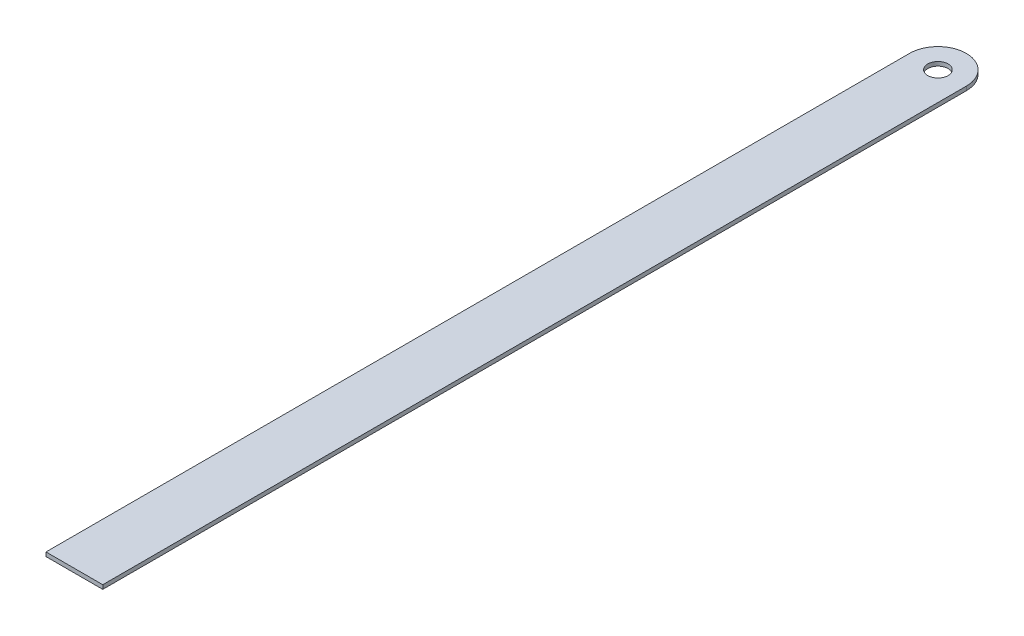
from build123d import *

# Parameters (mm, degrees)
SKETCH1_W           = 14
SKETCH1_H           = 200
BOSS_EXTRUDE1_DEPTH = 1
SKETCH2_R           = 2.5
BOSS_EXTRUDE2_DEPTH = 1


with BuildPart() as part:
    # Sketch1 → Boss-Extrude1 (new body)
    with BuildSketch(Plane(origin=(0, 0, 0), x_dir=(1, 0, 0), z_dir=(0, 1, 0))):
        with Locations((7, 100)):
            Rectangle(SKETCH1_W, SKETCH1_H)
    extrude(amount=BOSS_EXTRUDE1_DEPTH)

    # Sketch2 → Boss-Extrude2 (add)
    with BuildSketch(Plane.XZ):
        with BuildLine():
            Line((0, -200), (14, -200))
            Line((14, -200), (14, -213))
            ThreePointArc((14, -213), (7, -220), (0, -213))
            Line((0, -213), (0, -200))
        make_face()
        with Locations(Location((7, -213, 0), (0, 0, 270))):
            Circle(SKETCH2_R, mode=Mode.SUBTRACT)
    extrude(amount=-BOSS_EXTRUDE2_DEPTH)


solid = part.part
